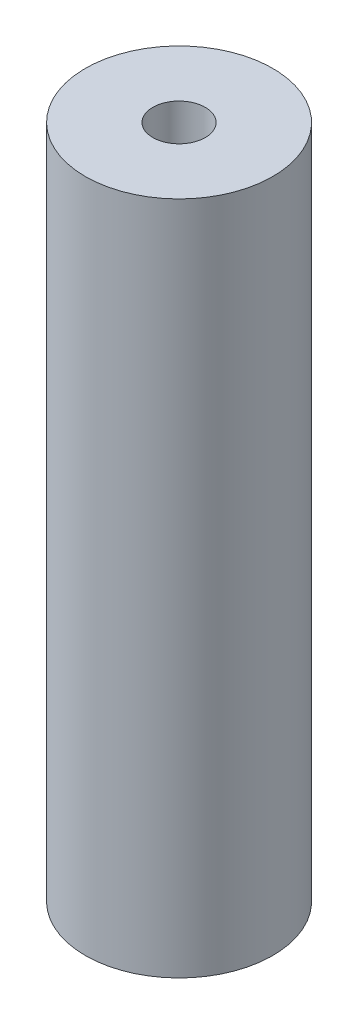
from build123d import *

# Parameters (mm, degrees)
SKETCH1_R           = 7.5
BOSS_EXTRUDE1_DEPTH = 54


with BuildPart() as part:
    # Sketch1 → Boss-Extrude1 (new body)
    with BuildSketch(Plane(origin=(0, 0, 0), x_dir=(1, 0, 0), z_dir=(0, 1, 0))):
        with Locations(Location((0, 0, 0), (0, 0, 270))):
            Circle(SKETCH1_R)
    extrude(amount=BOSS_EXTRUDE1_DEPTH)

    # Sketch3 → M5 Tapped Hole1 (revolve, cut)
    with BuildSketch(Plane(origin=(0, 54, 0), x_dir=(0, 0, 1), z_dir=(1, 0, 0))):
        Polygon((0, 0), (0, 13.6618073), (2.1, 12.4), (2.1, 0), align=None)
    m5_tapped_hole1 = revolve(axis=Axis((0, 60.35, 0), (0, -1, 0)), mode=Mode.SUBTRACT)

    # Mirror1: M5 Tapped Hole1 across plane
    add(m5_tapped_hole1.mirror(Plane.ZX.offset(27)), mode=Mode.SUBTRACT)


solid = part.part
